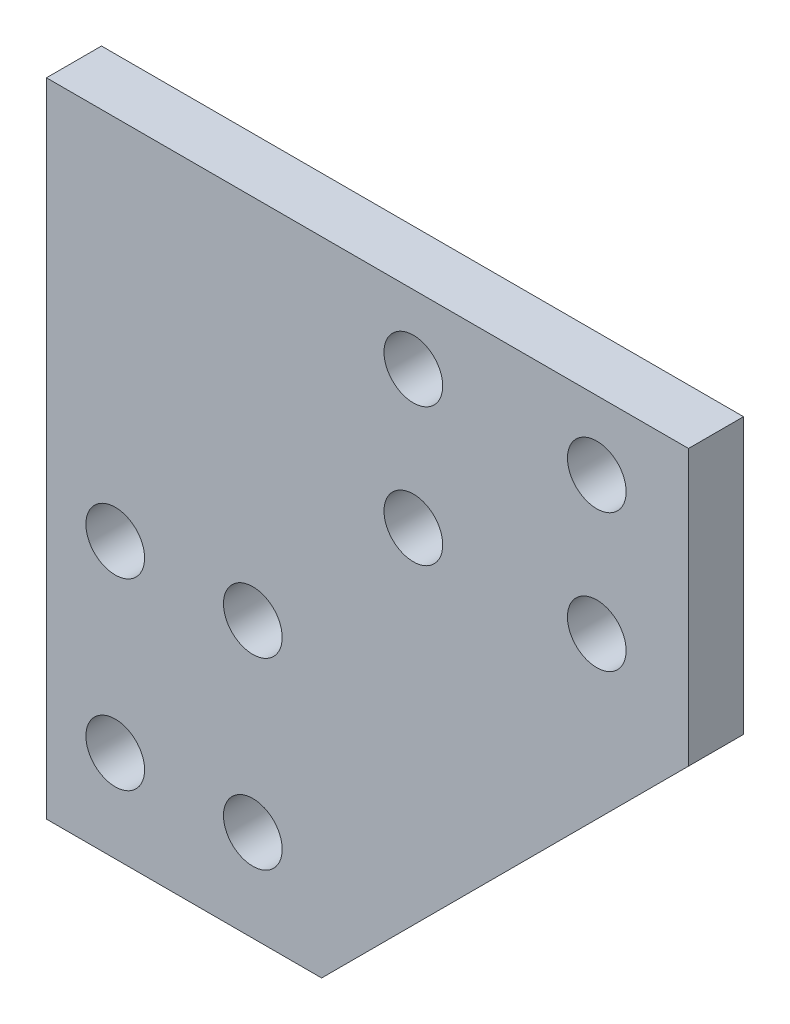
from build123d import *

# Parameters (mm, degrees)
SKETCH_1_R      = 1.6
EXTRUDE_1_DEPTH = 3


with BuildPart() as part:
    # 草图1 → 凸台-拉伸1 (new body)
    with BuildSketch(Plane.XY):
        Polygon((0, 0), (35, 0), (35, -15), (15, -35), (0, -35), align=None)
        with Locations((3.75, -30)):
            Circle(SKETCH_1_R, mode=Mode.SUBTRACT)
        with Locations(Location((11.25, -30, 0), (0, 0, 180))):
            Circle(SKETCH_1_R, mode=Mode.SUBTRACT)
        with Locations((11.25, -20)):
            Circle(SKETCH_1_R, mode=Mode.SUBTRACT)
        with Locations(Location((3.75, -20, 0), (0, 0, 180))):
            Circle(SKETCH_1_R, mode=Mode.SUBTRACT)
        with Locations((30, -3.75)):
            Circle(SKETCH_1_R, mode=Mode.SUBTRACT)
        with Locations(Location((30, -11.25, 0), (0, 0, 180))):
            Circle(SKETCH_1_R, mode=Mode.SUBTRACT)
        with Locations((20, -11.25)):
            Circle(SKETCH_1_R, mode=Mode.SUBTRACT)
        with Locations(Location((20, -3.75, 0), (0, 0, 180))):
            Circle(SKETCH_1_R, mode=Mode.SUBTRACT)
    extrude(amount=EXTRUDE_1_DEPTH)


solid = part.part
